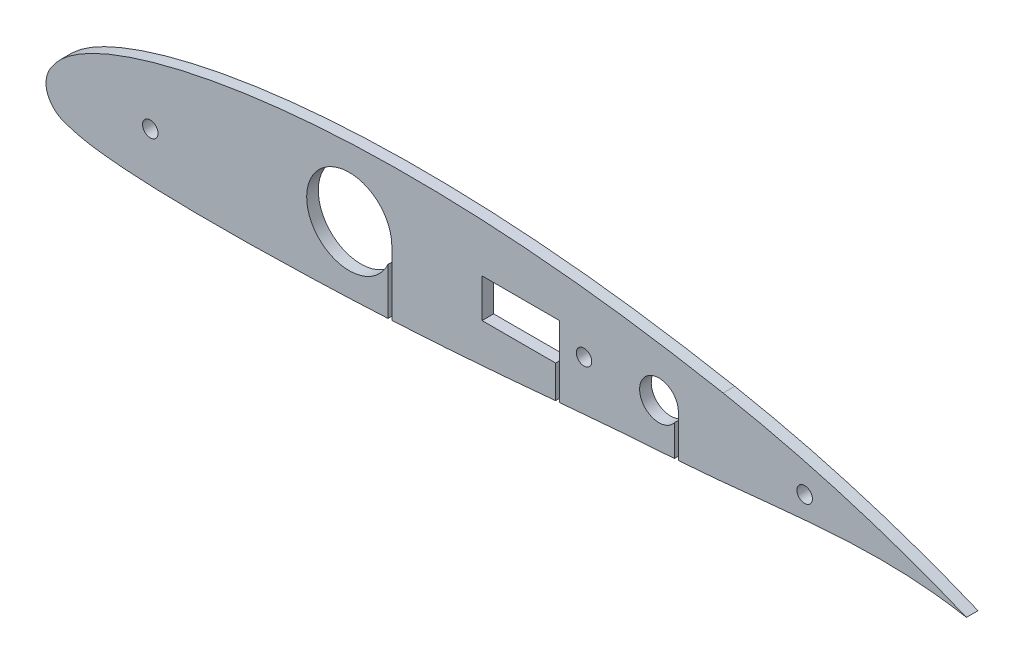
from build123d import *

# Parameters (mm, degrees)
SKETCH5_R           = 2
BOSS_EXTRUDE1_DEPTH = 3


with BuildPart() as part:
    # Sketch5 → Boss-Extrude1 (new body)
    with BuildSketch(Plane.XY):
        with BuildLine():
            ThreePointArc((-60.40676614, 16.162496642), (-81.15385877, 23.090280217), (-59.40676614, 20.745072337))
            Line((-59.40676614, 20.745072337), (-59.40676614, 4.127531865))
            add(Edge.make_bspline(
                [(-59.40676614, 4.127531865), (-56.018262466, 4.308098308), (-47.937394752, 4.779305212), (-35.160445535, 5.701220122), (-24.536889777, 6.648809407), (-18.536419357, 7.188062), (-17.192502191, 7.308335338), (-17.109161558, 7.315791129)],
                knots=[1.696187526, 1.696187526, 1.696187526, 1.696187526, 1.71875, 1.75, 1.78125, 1.789719737, 1.790279718, 1.790279718, 1.790279718, 1.790279718], degree=3))
            Line((-17.109161558, 7.315791129), (-17.109161558, 15.745072337))
            Line((-17.109161558, 15.745072337), (-36.109161558, 15.745072337))
            Line((-36.109161558, 15.745072337), (-36.109161558, 25.745072337))
            Line((-36.109161558, 25.745072337), (-16.109161558, 25.745072337))
            Line((-16.109161558, 25.745072337), (-16.109161558, 7.405095685))
            add(Edge.make_bspline(
                [(-16.109161558, 7.405095685), (-16.025835477, 7.412523422), (-13.052799236, 7.677419778), (-5.437797345, 8.345259497), (3.85457575, 9.082728966), (10.779350171, 9.549869356), (13.069020219, 9.692680395), (13.59323386, 9.72473994)],
                knots=[0.792519643, 0.792519643, 0.792519643, 0.792519643, 0.793079624, 0.8125, 0.84375, 0.855658983, 0.859195484, 0.859195484, 0.859195484, 0.859195484], degree=3))
            Line((13.59323386, 9.72473994), (13.59323386, 17.745072337))
            ThreePointArc((13.59323386, 17.745072337), (4.84981737, 22.326211167), (14.59323386, 20.745072337))
            Line((14.59323386, 20.745072337), (14.59323386, 9.787860429))
            add(Edge.make_bspline(
                [(14.59323386, 9.787860429), (39.457967562, 11.405371782), (63.914204067, 16.521781828), (89.001589365, 11.90459949)],
                knots=[0.013225622, 0.013225622, 0.013225622, 0.013225622, 1, 1, 1, 1], degree=3))
            add(Edge.make_bspline(
                [(26.170479229, 30.680952694), (58.67186968, 24.512007909), (89.001589365, 11.90459949)],
                knots=[0.042583337, 0.042583337, 0.042583337, 1, 1, 1], degree=2))
            add(Edge.make_bspline(
                [(26.170479229, 30.680952694), (25.205886107, 30.862092815), (24.240734662, 31.040790729), (23.275033018, 31.216972304)],
                knots=[1.117594243, 1.117594243, 1.117594243, 1.117594243, 1.124095827, 1.124095827, 1.124095827, 1.124095827], degree=3))
            add(Edge.make_bspline(
                [(23.275033018, 31.216972304), (23.140733298, 31.241473801), (20.685406709, 31.688495788), (15.90216026, 32.526318551), (6.579010651, 34.033015696), (-5.133055867, 35.666116217), (-19.248648242, 37.161252915), (-33.403308977, 38.20593019), (-47.608866156, 38.758894607), (-61.832005855, 38.778890697), (-73.705471575, 38.305381276), (-83.196414477, 37.581775934), (-90.308420977, 36.856137814), (-97.405481968, 35.933533463), (-104.49016779, 34.799284224), (-111.557384973, 33.413801047), (-117.418017458, 32.027174852), (-122.09641574, 30.737665101), (-125.595780154, 29.665409457), (-129.078314362, 28.475065768), (-132.551428441, 27.135989205), (-135.438628175, 25.862245696), (-137.734204273, 24.71275654), (-139.456975035, 23.768735976), (-141.183426847, 22.709562699), (-142.615229884, 21.713760032), (-143.77801007, 20.791584153), (-144.64229668, 20.031352217), (-145.488501269, 19.19176817), (-146.295459406, 18.276470341), (-146.924853395, 17.446015374), (-147.402133683, 16.747920086), (-147.861509392, 15.987282184), (-148.257481402, 15.133627504), (-148.525334699, 14.278259778), (-148.652359182, 13.678916684), (-148.715065867, 13.146222117), (-148.743623834, 12.770251932), (-148.736306405, 12.117079484), (-148.641099684, 11.351840339), (-148.411222249, 10.482363072), (-147.899630282, 9.332709382), (-147.131184272, 8.253388514), (-146.09059598, 7.280250853), (-145.034194907, 6.604319102), (-144.09938882, 6.176356092), (-143.327943825, 5.907252288), (-142.744414151, 5.736973351), (-142.324681369, 5.618090192), (-141.71235566, 5.446636379), (-140.948050307, 5.240930245), (-139.679457393, 4.923190904), (-138.006428537, 4.575929196), (-136.079399861, 4.278568877), (-134.232487666, 4.048200208), (-132.422823202, 3.849021219), (-130.005739206, 3.616900261), (-126.996429968, 3.386691085), (-123.404146632, 3.187128712), (-119.83886834, 3.041019315), (-116.279828867, 2.935449875), (-111.547802169, 2.840398079), (-105.642152982, 2.793208736), (-98.571156918, 2.826637665), (-91.511359598, 2.931514837), (-84.458643007, 3.096931382), (-75.057376873, 3.391022167), (-67.043131258, 3.735636358), (-61.378179064, 4.023923464), (-60.40676614, 4.074735486)],
                knots=[1.124095827, 1.124095827, 1.124095827, 1.124095827, 1.125, 1.140625, 1.15625, 1.1875, 1.21875, 1.25, 1.28125, 1.3125, 1.34375, 1.359375, 1.375, 1.390625, 1.40625, 1.421875, 1.4375, 1.4453125, 1.453125, 1.4609375, 1.46875, 1.4765625, 1.48046875, 1.484375, 1.48828125, 1.4921875, 1.494140625, 1.49609375, 1.498046875, 1.5, 1.501953125, 1.502929688, 1.50390625, 1.504882812, 1.505371094, 1.505859375, 1.506103516, 1.506347656, 1.506591797, 1.506835938, 1.507324219, 1.5078125, 1.508789062, 1.509765625, 1.510742188, 1.51171875, 1.512695312, 1.513671875, 1.514648438, 1.515625, 1.517578125, 1.51953125, 1.5234375, 1.52734375, 1.53125, 1.53515625, 1.5390625, 1.546875, 1.5546875, 1.5625, 1.5703125, 1.578125, 1.59375, 1.609375, 1.625, 1.640625, 1.65625, 1.6875, 1.693968039, 1.693968039, 1.693968039, 1.693968039], degree=3))
            Line((-60.40676614, 4.074735486), (-60.40676614, 16.162496642))
        make_face()
        with Locations((-121.802810719, 15.770135151)):
            Circle(SKETCH5_R, mode=Mode.SUBTRACT)
        with Locations((-9.768805549, 20.745072337)):
            Circle(SKETCH5_R, mode=Mode.SUBTRACT)
        with Locations((47.224088979, 18.510484191)):
            Circle(SKETCH5_R, mode=Mode.SUBTRACT)
    extrude(amount=BOSS_EXTRUDE1_DEPTH)


solid = part.part
